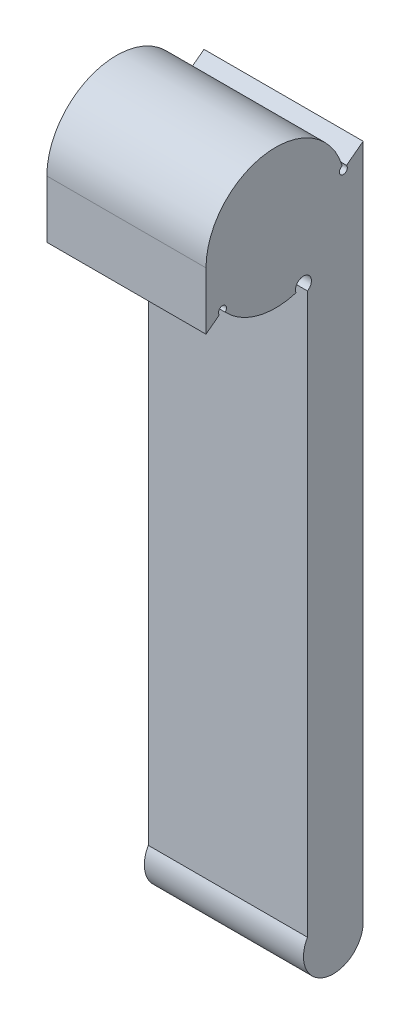
from build123d import *

# Parameters (mm, degrees)
BOSS_EXTRUDE1_DEPTH = 8
CUT_EXTRUDE1_DEPTH  = 38.332956939


with BuildPart() as part:
    # Sketch1 → Boss-Extrude1 (new body)
    with BuildSketch(Plane.YZ):
        with BuildLine():
            Line((21.778218983, -15.260770999), (22.403447361, -16.090477082))
            ThreePointArc((22.403447361, -16.090477082), (21.256795907, -17.969098146), (21.458282303, -20.160770999))
            Line((21.458282303, -20.160770999), (-7.771266811, -20.160770999))
            ThreePointArc((-7.771266811, -20.160770999), (-9.271266811, -21.660770999), (-7.771266811, -23.160770999))
            Line((-7.771266811, -23.160770999), (26.228733189, -23.160770999))
            Line((26.228733189, -23.160770999), (25.478499604, -22.165177406))
            ThreePointArc((25.478499604, -22.165177406), (28.142104739, -18.351761478), (24.66608529, -15.260770999))
            Line((24.66608529, -15.260770999), (21.778218983, -15.260770999))
        make_face()
    extrude(amount=BOSS_EXTRUDE1_DEPTH)

    # Sketch2 → Cut-Extrude1 (cut, through all)
    with BuildSketch(Plane(origin=(0, 0, 0), x_dir=(0, -1, 0), z_dir=(-1, 0, 0))):
        with BuildLine():
            ThreePointArc((-22.283084357, -15.93074998), (-22.602512003, -16.109797243), (-22.254615534, -16.224077557))
            ThreePointArc((-22.254615534, -16.224077557), (-22.328076964, -16.156214018), (-22.403447361, -16.090477082))
            Line((-22.403447361, -16.090477082), (-22.283084357, -15.93074998))
        make_face()
        with BuildLine():
            ThreePointArc((-21.458282303, -20.160770999), (-21.383523815, -19.975180388), (-21.319492659, -19.785621116))
            ThreePointArc((-21.319492659, -19.785621116), (-21.83451901, -20.296586831), (-21.111872142, -20.360770999))
            Line((-21.111872142, -20.360770999), (-21.458282303, -20.160770999))
        make_face()
        with BuildLine():
            Line((-25.478499604, -22.165177406), (-25.598862609, -22.324904508))
            ThreePointArc((-25.598862609, -22.324904508), (-25.289362351, -22.100161258), (-25.671631303, -22.113214469))
            ThreePointArc((-25.671631303, -22.113214469), (-25.575436693, -22.140575731), (-25.478499604, -22.165177406))
        make_face()
        with BuildLine():
            ThreePointArc((7.771266811, -20.160770999), (7.383968477, -20.211633325), (7.022935334, -20.360770999))
            Line((7.022935334, -20.360770999), (-21.111872142, -20.360770999))
            Line((-21.111872142, -20.360770999), (-21.458282303, -20.160770999))
            Line((-21.458282303, -20.160770999), (7.771266811, -20.160770999))
        make_face()
        with BuildLine():
            Line((-21.319492659, -20.160770999), (-21.319492659, -19.785621116))
            ThreePointArc((-21.319492659, -19.785621116), (-21.383523815, -19.975180388), (-21.458282303, -20.160770999))
            Line((-21.458282303, -20.160770999), (-21.319492659, -20.160770999))
        make_face()
        with BuildLine():
            Line((-25.671631303, -22.113214469), (-25.598862609, -22.324904508))
            Line((-25.598862609, -22.324904508), (-25.478499604, -22.165177406))
            ThreePointArc((-25.478499604, -22.165177406), (-25.575436693, -22.140575731), (-25.671631303, -22.113214469))
        make_face()
        with BuildLine():
            ThreePointArc((-22.403447361, -16.090477082), (-22.328076964, -16.156214018), (-22.254615534, -16.224077557))
            Line((-22.254615534, -16.224077557), (-22.283084357, -15.93074998))
            Line((-22.283084357, -15.93074998), (-22.403447361, -16.090477082))
        make_face()
    extrude(amount=-CUT_EXTRUDE1_DEPTH, mode=Mode.SUBTRACT)


solid = part.part
